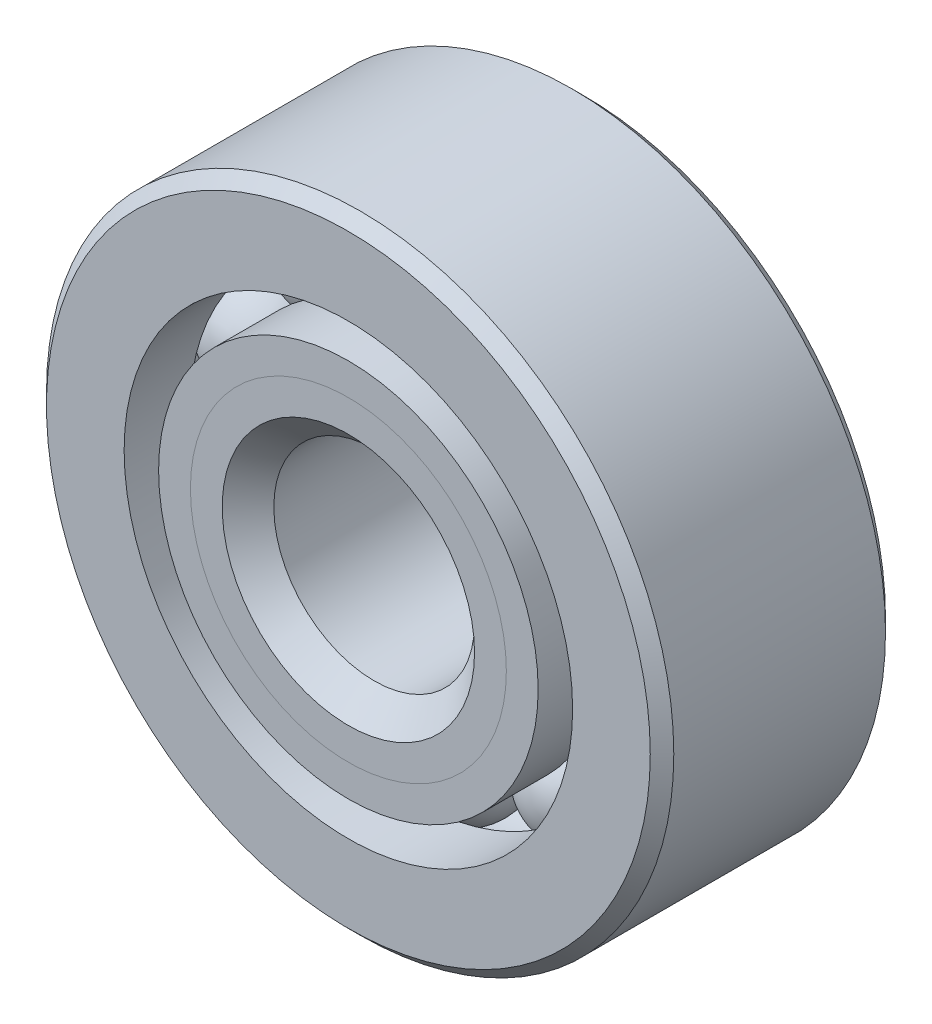
from build123d import *

# Parameters (mm, degrees)
CIRPATTERN1_COUNT = 10


with BuildPart() as part:
    # Sketch1 → Revolve1 (revolve)
    with BuildSketch(Plane(origin=(0, 0, 0), x_dir=(0, 0, -1), z_dir=(1, 0, 0))):
        with BuildLine():
            Line((0.53578125, 1.5875), (-0.53578125, 1.5875))
            Line((-0.53578125, 1.5875), (-0.5953125, 1.52796875))
            Line((-0.5953125, 1.52796875), (-0.5953125, 1.134975275))
            Line((-0.5953125, 1.134975275), (-0.264583333, 1.134975275))
            ThreePointArc((-0.264583333, 1.134975275), (0, 1.32634036), (0.264583333, 1.134975275))
            Line((0.264583333, 1.134975275), (0.5953125, 1.134975275))
            Line((0.5953125, 1.134975275), (0.5953125, 1.52796875))
            Line((0.5953125, 1.52796875), (0.53578125, 1.5875))
        make_face()
    revolve(axis=Axis((0, 0, 0.5953125), (0, 0, -1)))


with BuildPart() as body_2:
    # Sketch2 → Revolve2 (revolve)
    with BuildSketch(Plane(origin=(0, 0, 0), x_dir=(0, 0, -1), z_dir=(1, 0, 0))):
        with BuildLine():
            Line((-0.5953125, 0.960524725), (-0.264583333, 0.960524725))
            ThreePointArc((-0.264583333, 0.960524725), (-0.16326737, 0.822014857), (0, 0.76915964))
            Line((0, 0.76915964), (0, 0.63857982))
            Line((0, 0.63857982), (-0.434340047, 0.63857982))
            Line((-0.434340047, 0.63857982), (-0.5953125, 0.799552273))
            Line((-0.5953125, 0.799552273), (-0.5953125, 0.960524725))
        make_face()
    revolve(axis=Axis((0, 0, 0.5953125), (0, 0, -1)))


with BuildPart() as body_3:
    # Sketch3 → Revolve3 (revolve)
    with BuildSketch(Plane(origin=(0, 0, 0), x_dir=(0, 0, -1), z_dir=(1, 0, 0))):
        with BuildLine():
            Line((-0.5953125, 0.799552273), (-0.434340047, 0.63857982))
            Line((-0.434340047, 0.63857982), (0, 0.63857982))
            Line((0, 0.63857982), (0, 0.76915964))
            ThreePointArc((0, 0.76915964), (0.16326737, 0.822014857), (0.264583333, 0.960524725))
            Line((0.264583333, 0.960524725), (0.5953125, 0.960524725))
            Line((0.5953125, 0.960524725), (0.5953125, 0.56753125))
            Line((0.5953125, 0.56753125), (0.53578125, 0.508))
            Line((0.53578125, 0.508), (-0.46473268, 0.508))
            Line((-0.46473268, 0.508), (-0.5953125, 0.63857982))
            Line((-0.5953125, 0.63857982), (-0.5953125, 0.799552273))
        make_face()
    revolve(axis=Axis((0, 0, 0.5953125), (0, 0, -1)))


with BuildPart() as body_4:
    # Sketch4 → Revolve4 (revolve)
    with BuildSketch(Plane(origin=(0, 0, 0), x_dir=(0, 0, -1), z_dir=(1, 0, 0))):
        with BuildLine():
            Line((-0.27859036, 1.04775), (0.27859036, 1.04775))
            ThreePointArc((0.27859036, 1.04775), (0, 1.32634036), (-0.27859036, 1.04775))
        make_face()
    revolve(axis=Axis((0, 1.04775, 0.27859036), (0, 0, -1)))


with BuildPart() as cirpattern1_1:
    # CirPattern1: pattern copy
    add(body_4.part.rotate(Axis((0, 0, -0.5953125), (0, 0, 1)), 1 * 360 / CIRPATTERN1_COUNT))


with BuildPart() as cirpattern1_2:
    # CirPattern1: pattern copy
    add(body_4.part.rotate(Axis((0, 0, -0.5953125), (0, 0, 1)), 2 * 360 / CIRPATTERN1_COUNT))


with BuildPart() as cirpattern1_3:
    # CirPattern1: pattern copy
    add(body_4.part.rotate(Axis((0, 0, -0.5953125), (0, 0, 1)), 3 * 360 / CIRPATTERN1_COUNT))


with BuildPart() as cirpattern1_4:
    # CirPattern1: pattern copy
    add(body_4.part.rotate(Axis((0, 0, -0.5953125), (0, 0, 1)), 4 * 360 / CIRPATTERN1_COUNT))


with BuildPart() as cirpattern1_5:
    # CirPattern1: pattern copy
    add(body_4.part.rotate(Axis((0, 0, -0.5953125), (0, 0, 1)), 5 * 360 / CIRPATTERN1_COUNT))


with BuildPart() as cirpattern1_6:
    # CirPattern1: pattern copy
    add(body_4.part.rotate(Axis((0, 0, -0.5953125), (0, 0, 1)), 6 * 360 / CIRPATTERN1_COUNT))


with BuildPart() as cirpattern1_7:
    # CirPattern1: pattern copy
    add(body_4.part.rotate(Axis((0, 0, -0.5953125), (0, 0, 1)), 7 * 360 / CIRPATTERN1_COUNT))


with BuildPart() as cirpattern1_8:
    # CirPattern1: pattern copy
    add(body_4.part.rotate(Axis((0, 0, -0.5953125), (0, 0, 1)), 8 * 360 / CIRPATTERN1_COUNT))


with BuildPart() as cirpattern1_9:
    # CirPattern1: pattern copy
    add(body_4.part.rotate(Axis((0, 0, -0.5953125), (0, 0, 1)), 9 * 360 / CIRPATTERN1_COUNT))


solid = Compound([part.part, body_2.part, body_3.part, body_4.part, cirpattern1_1.part, cirpattern1_2.part, cirpattern1_3.part, cirpattern1_4.part, cirpattern1_5.part, cirpattern1_6.part, cirpattern1_7.part, cirpattern1_8.part, cirpattern1_9.part])
